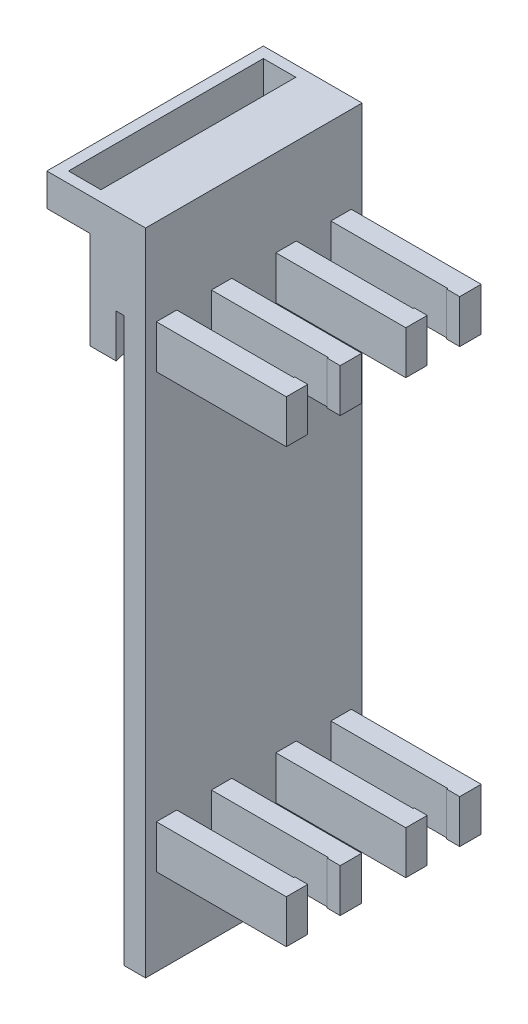
from build123d import *

# Parameters (mm, degrees)
BOSS_EXTRUDE1_DEPTH       = 50
SKETCH2_W                 = 4.7
SKETCH2_H                 = 10
BOSS_EXTRUDE2_DEPTH       = 30
SKETCH3_W                 = 5
SKETCH3_H                 = 50
BOSS_EXTRUDE3_DEPTH       = 120
SKETCH4_W                 = 3
SKETCH4_H                 = 10
BOSS_EXTRUDE4_DEPTH       = 0.25
SKETCH5_W                 = 3
SKETCH5_H                 = 10
BOSS_EXTRUDE5_DEPTH       = 0.25
LPATTERN1_COUNT           = 2
LPATTERN1_PITCH           = 27.6
LPATTERN2_COUNT           = 2
LPATTERN2_PITCH           = 100
LPATTERN2_COPY_1_SKETCH_W = 4.7
LPATTERN2_COPY_1_SKETCH_H = 10
LPATTERN2_COPY_1_DEPTH    = 30
LPATTERN2_COPY_2_SKETCH_W = 3
LPATTERN2_COPY_2_SKETCH_H = 10
LPATTERN2_COPY_2_DEPTH    = 0.25
LPATTERN2_COPY_3_SKETCH_W = 3
LPATTERN2_COPY_3_SKETCH_H = 10
LPATTERN2_COPY_3_DEPTH    = 0.25
CORTE_EXTRUS_O1_DEPTH     = 10
ESBO_O3_W                 = 50
ESBO_O3_H                 = 7.5
RESSALTO_EXTRUS_O2_DEPTH  = 10
ESBO_O4_W                 = 7.5
ESBO_O4_H                 = 45
CORTE_EXTRUS_O2_DEPTH     = 10


with BuildPart() as part:
    # Sketch1 → Boss-Extrude1 (new body)
    with BuildSketch(Plane.XY):
        Polygon((0, 0), (0, 30), (12.8, 30), (12.8, 0), (7.8, 0), (7.8, 10), (6, 10), (6, 0), align=None)
    extrude(amount=BOSS_EXTRUDE1_DEPTH)

    # Sketch2 → Boss-Extrude2 (add)
    with BuildSketch(Plane(origin=(12.8, 0, 0), x_dir=(0, 0, -1), z_dir=(1, 0, 0))):
        with Locations((-45.15, 5)):
            Rectangle(SKETCH2_W, SKETCH2_H)
        with Locations((-32.45, 5)):
            Rectangle(SKETCH2_W, SKETCH2_H)
    boss_extrude2 = extrude(amount=BOSS_EXTRUDE2_DEPTH)

    # Sketch3 → Boss-Extrude3 (add)
    with BuildSketch(Plane.XZ):
        with Locations((10.3, 25)):
            Rectangle(SKETCH3_W, SKETCH3_H)
    extrude(amount=BOSS_EXTRUDE3_DEPTH)

    # Sketch4 → Boss-Extrude4 (add)
    with BuildSketch(Plane(origin=(0, 0, 42.8), x_dir=(-1, 0, 0), z_dir=(0, 0, -1))):
        with Locations((-41.3, 5)):
            Rectangle(SKETCH4_W, SKETCH4_H)
    boss_extrude4 = extrude(amount=BOSS_EXTRUDE4_DEPTH)

    # Sketch5 → Boss-Extrude5 (add)
    with BuildSketch(Plane.XY.offset(34.8)):
        with Locations((41.3, 5)):
            Rectangle(SKETCH5_W, SKETCH5_H)
    boss_extrude5 = extrude(amount=BOSS_EXTRUDE5_DEPTH)

    # LPattern1: Boss-Extrude2, Boss-Extrude4, Boss-Extrude5 ×2
    with Locations(*[(0, 0, -i * LPATTERN1_PITCH) for i in range(1, LPATTERN1_COUNT)]):
        add(boss_extrude2)
        add(boss_extrude4)
        add(boss_extrude5)

    # LPattern2: Boss-Extrude2, Boss-Extrude4, Boss-Extrude5 ×2
    with Locations(*[(0, -i * LPATTERN2_PITCH, 0) for i in range(1, LPATTERN2_COUNT)]):
        add(boss_extrude2)
        add(boss_extrude4)
        add(boss_extrude5)

    # LPattern2 copy 1 sketch → LPattern2 copy 1 (add)
    with BuildSketch(Plane(origin=(12.8, -100, -27.6), x_dir=(0, 0, -1), z_dir=(1, 0, 0))):
        with Locations((-45.15, 5)):
            Rectangle(LPATTERN2_COPY_1_SKETCH_W, LPATTERN2_COPY_1_SKETCH_H)
        with Locations((-32.45, 5)):
            Rectangle(LPATTERN2_COPY_1_SKETCH_W, LPATTERN2_COPY_1_SKETCH_H)
    extrude(amount=LPATTERN2_COPY_1_DEPTH)

    # LPattern2 copy 2 sketch → LPattern2 copy 2 (add)
    with BuildSketch(Plane(origin=(0, -100, 15.2), x_dir=(-1, 0, 0), z_dir=(0, 0, -1))):
        with Locations((-41.3, 5)):
            Rectangle(LPATTERN2_COPY_2_SKETCH_W, LPATTERN2_COPY_2_SKETCH_H)
    extrude(amount=LPATTERN2_COPY_2_DEPTH)

    # LPattern2 copy 3 sketch → LPattern2 copy 3 (add)
    with BuildSketch(Plane(origin=(0, -100, 7.2), x_dir=(1, 0, 0), z_dir=(0, 0, 1))):
        with Locations((41.3, 5)):
            Rectangle(LPATTERN2_COPY_3_SKETCH_W, LPATTERN2_COPY_3_SKETCH_H)
    extrude(amount=LPATTERN2_COPY_3_DEPTH)

    # Esboço2 → Corte-extrusão1 (cut)
    with BuildSketch(Plane.XZ):
        with BuildLine():
            Line((6, 50), (6, 0))
            ThreePointArc((6, 0), (2.708949196, 25), (6, 50))
        make_face()
    extrude(amount=-CORTE_EXTRUS_O1_DEPTH, mode=Mode.SUBTRACT)

    # Esboço3 → Ressalto-extrusão2 (add)
    with BuildSketch(Plane.ZY):
        with Locations((25, 26.25)):
            Rectangle(ESBO_O3_W, ESBO_O3_H)
    extrude(amount=RESSALTO_EXTRUS_O2_DEPTH)

    # Esboço4 → Corte-extrusão2 (cut)
    with BuildSketch(Plane.XZ.offset(-22.5)):
        with Locations((-3.75, 25)):
            Rectangle(ESBO_O4_W, ESBO_O4_H)
    extrude(amount=-CORTE_EXTRUS_O2_DEPTH, mode=Mode.SUBTRACT)


solid = part.part
